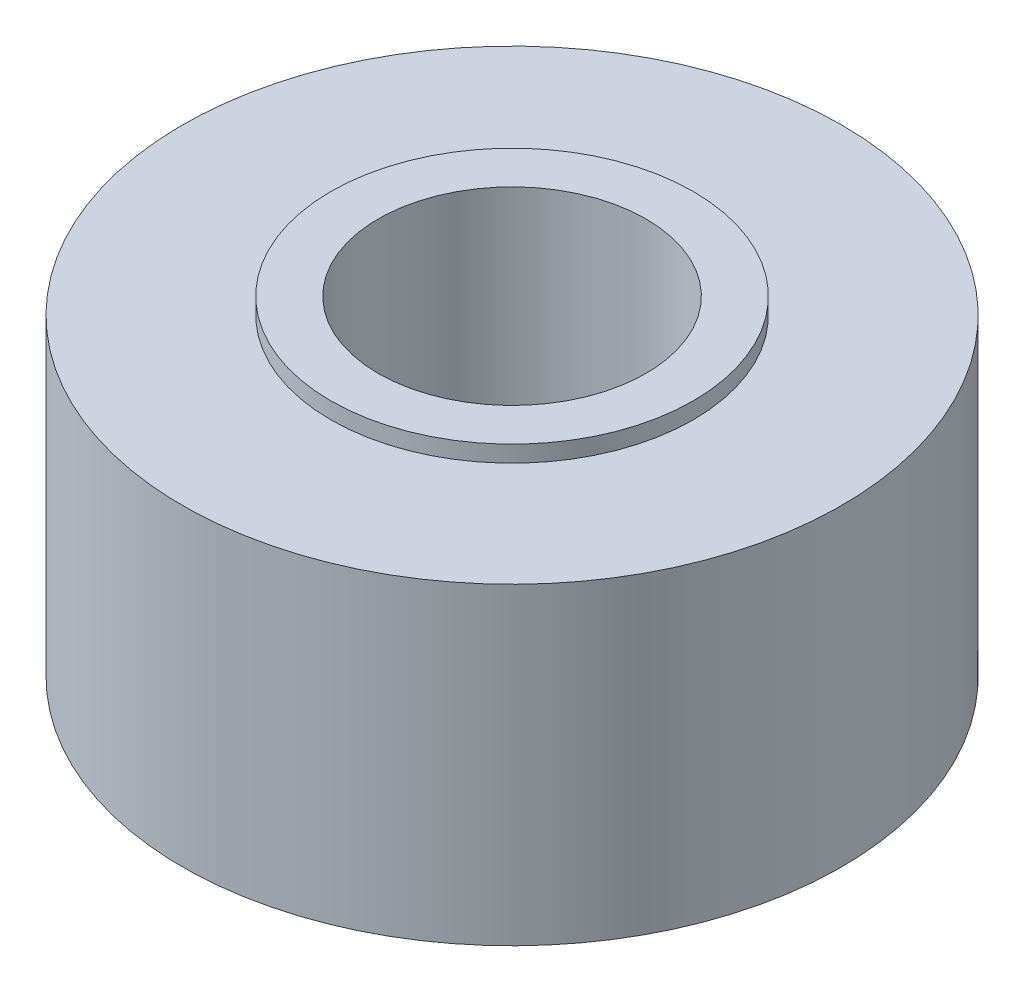
from build123d import *

# Parameters (mm, degrees)
CROQUIS1_R              = 4
CROQUIS1_R_2            = 1.625
SALIENTE_EXTRUIR1_DEPTH = 3.8
CROQUIS2_R              = 2.2
CROQUIS2_R_2            = 1.625
SALIENTE_EXTRUIR2_DEPTH = 0.2


with BuildPart() as part:
    # Croquis1 → Saliente-Extruir1 (new body)
    with BuildSketch(Plane(origin=(0, 0, 0), x_dir=(1, 0, 0), z_dir=(0, 1, 0))):
        with Locations(Location((0, 0, 0), (0, 0, 90))):
            Circle(CROQUIS1_R)
        with Locations(Location((0, 0, 0), (0, 0, 90))):
            Circle(CROQUIS1_R_2, mode=Mode.SUBTRACT)
    extrude(amount=SALIENTE_EXTRUIR1_DEPTH)

    # Croquis2 → Saliente-Extruir2 (add)
    with BuildSketch(Plane(origin=(0, 3.8, 0), x_dir=(1, 0, 0), z_dir=(0, 1, 0))):
        with Locations(Location((0, 0, 0), (0, 0, 270))):
            Circle(CROQUIS2_R)
        with Locations(Location((0, 0, 0), (0, 0, 90))):
            Circle(CROQUIS2_R_2, mode=Mode.SUBTRACT)
    extrude(amount=SALIENTE_EXTRUIR2_DEPTH)


solid = part.part
